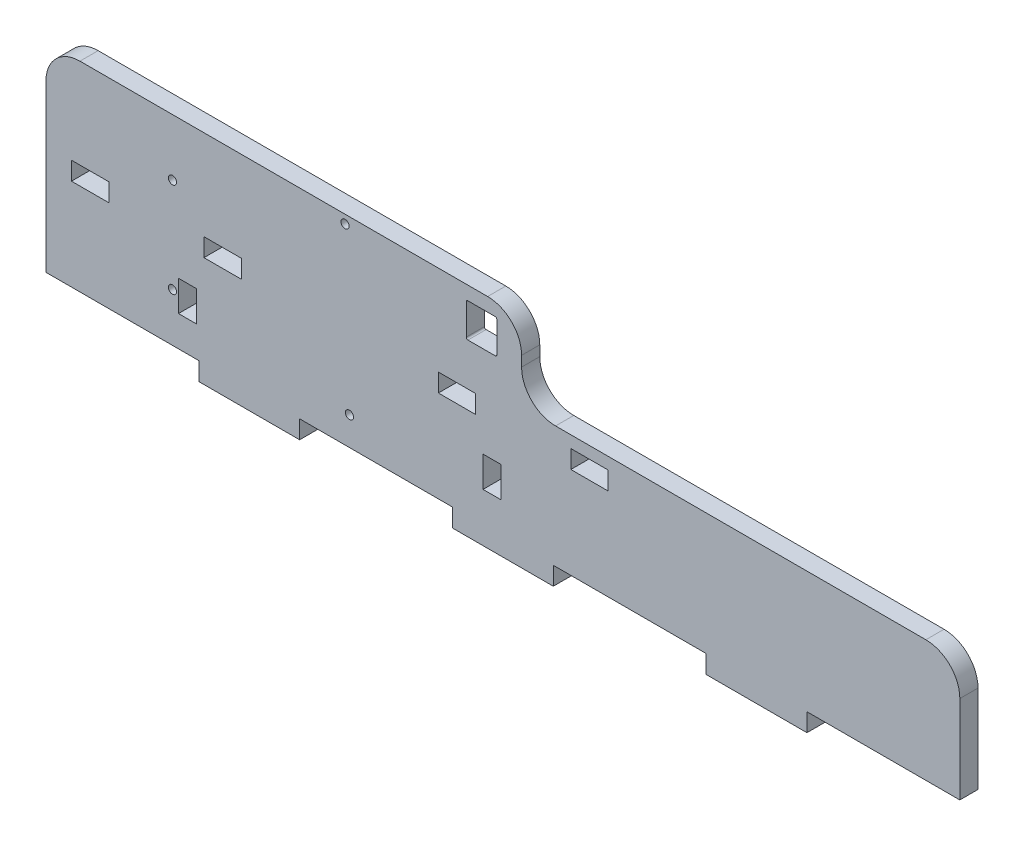
from build123d import *

# Parameters (mm, degrees)
MODEL_R             = 1.2
MODEL_W             = 11
MODEL_H             = 5.35
MODEL_W_2           = 5.35
MODEL_H_2           = 9
BOSS_EXTRUDE1_DEPTH = 5.35


with BuildPart() as part:
    # Model → Boss-Extrude1 (new body)
    with BuildSketch(Plane.XY):
        with BuildLine():
            Line((0, 0), (45.001, 0))
            Line((45.001, 0), (45.001, -5.35))
            Line((45.001, -5.35), (74.667, -5.35))
            Line((74.667, -5.35), (74.667, 0))
            Line((74.667, 0), (119.667, 0))
            Line((119.667, 0), (119.667, -5.35))
            Line((119.667, -5.35), (149.333, -5.35))
            Line((149.333, -5.35), (149.333, 0))
            Line((149.333, 0), (194.333, 0))
            Line((194.333, 0), (194.333, -5.35))
            Line((194.333, -5.35), (223.999, -5.35))
            Line((223.999, -5.35), (223.999, 0))
            Line((223.999, 0), (269, 0))
            Line((269, 0), (269, 25.85))
            ThreePointArc((269, 25.85), (266.071067812, 32.921067812), (259, 35.85))
            Line((259, 35.85), (150, 35.85))
            ThreePointArc((150, 35.85), (142.928932188, 38.778932188), (140, 45.85))
            Line((140, 45.85), (140, 48.85))
            ThreePointArc((140, 48.85), (137.071067812, 55.921067812), (130, 58.85))
            Line((130, 58.85), (10, 58.85))
            ThreePointArc((10, 58.85), (2.928932188, 55.921067812), (0, 48.85))
            Line((0, 48.85), (0, 0))
        make_face()
        with Locations((37.23, 42.15)):
            Circle(MODEL_R, mode=Mode.SUBTRACT)
        with Locations((88.03, 56.35)):
            Circle(MODEL_R, mode=Mode.SUBTRACT)
        with Locations((89.33, 8.35)):
            Circle(MODEL_R, mode=Mode.SUBTRACT)
        with Locations((37.23, 14.25)):
            Circle(MODEL_R, mode=Mode.SUBTRACT)
        with Locations((13, 29.675)):
            Rectangle(MODEL_W, MODEL_H, mode=Mode.SUBTRACT)
        with Locations((52, 29.675)):
            Rectangle(MODEL_W, MODEL_H, mode=Mode.SUBTRACT)
        with Locations((121, 29.675)):
            Rectangle(MODEL_W, MODEL_H, mode=Mode.SUBTRACT)
        with Locations((160, 29.675)):
            Rectangle(MODEL_W, MODEL_H, mode=Mode.SUBTRACT)
        with Locations((41.675, 13.5)):
            Rectangle(MODEL_W_2, MODEL_H_2, mode=Mode.SUBTRACT)
        with Locations((131.325, 13.5)):
            Rectangle(MODEL_W_2, MODEL_H_2, mode=Mode.SUBTRACT)
        with BuildLine():
            Line((124.21, 54.85), (132.21, 54.85))
            ThreePointArc((132.21, 54.85), (132.563553391, 54.703553391), (132.71, 54.35))
            Line((132.71, 54.35), (132.71, 45.35))
            ThreePointArc((132.71, 45.35), (132.563553391, 44.996446609), (132.21, 44.85))
            Line((132.21, 44.85), (124.21, 44.85))
            ThreePointArc((124.21, 44.85), (123.856446609, 44.996446609), (123.71, 45.35))
            Line((123.71, 45.35), (123.71, 54.35))
            ThreePointArc((123.71, 54.35), (123.856446609, 54.703553391), (124.21, 54.85))
        make_face(mode=Mode.SUBTRACT)
    extrude(amount=BOSS_EXTRUDE1_DEPTH)


solid = part.part
